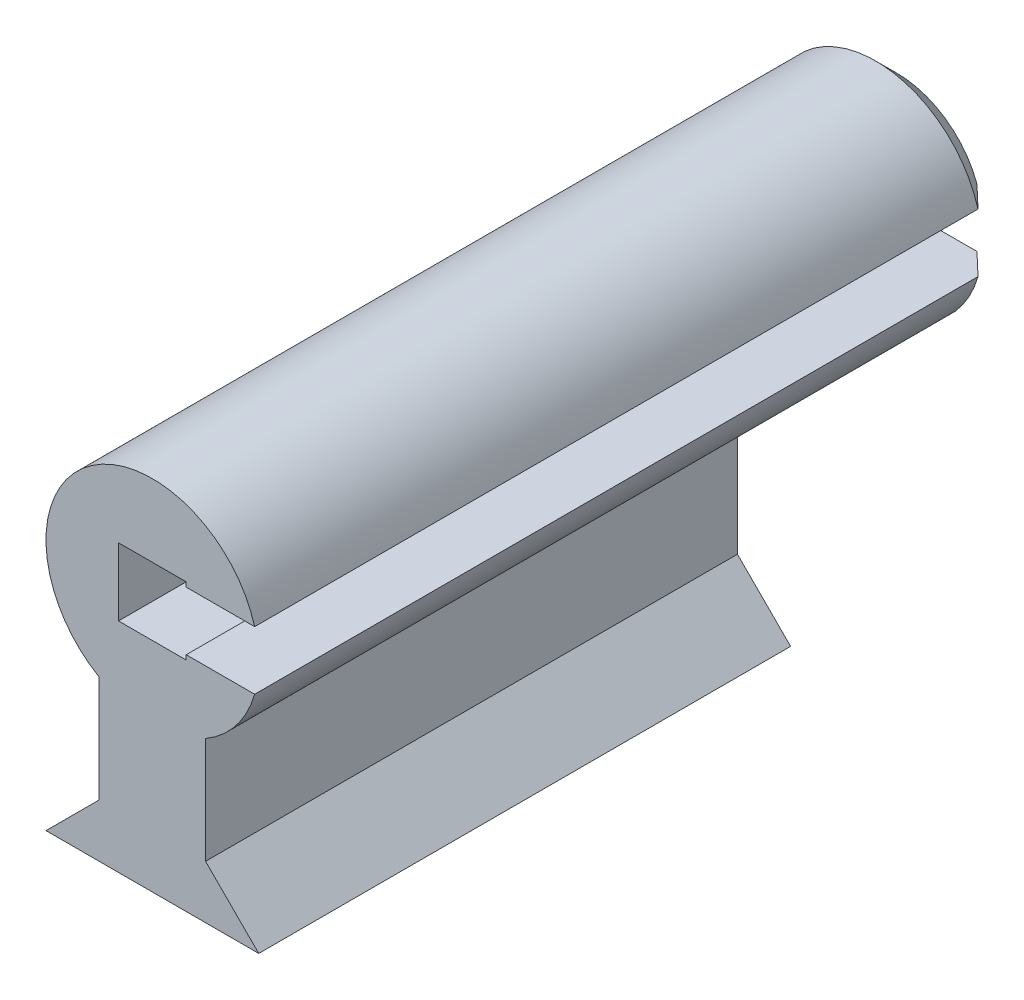
from build123d import *

# Parameters (mm, degrees)
BOSS_EXTRU_1_DEPTH      = 60
BOSS_EXTRU_1_DEPTH_BACK = 10
BOSS_EXTRU_2_START      = -50
BOSS_EXTRU_2_DEPTH      = 50
CHANFREIN1_SIZE         = 2


with BuildPart() as part:
    # Esquisse1 → Boss.-Extru.1 (new, two sides: drawn at the far end of the back side and taken through both)
    with BuildSketch(Plane.XY.offset(-BOSS_EXTRU_1_DEPTH_BACK)):
        with BuildLine():
            Line((3.181980515, 2.75), (3.181980515, 3.181980515))
            Line((3.181980515, 3.181980515), (-3.181980515, 3.181980515))
            Line((-3.181980515, 3.181980515), (-3.181980515, -3.181980515))
            Line((-3.181980515, -3.181980515), (3.181980515, -3.181980515))
            Line((3.181980515, -3.181980515), (3.181980515, -2.75))
            Line((3.181980515, -2.75), (9.614442262, -2.75))
            ThreePointArc((9.614442262, -2.75), (-10, 0), (9.614442262, 2.75))
            Line((9.614442262, 2.75), (3.181980515, 2.75))
        make_face()
    extrude(amount=BOSS_EXTRU_1_DEPTH + BOSS_EXTRU_1_DEPTH_BACK)

    # Esquisse3 → Boss.-Extru.2 (add)
    with BuildSketch(Plane.XY.offset(60).offset(BOSS_EXTRU_2_START)):
        with BuildLine():
            Line((5, -8.660254038), (5, -18.660254038))
            Line((5, -18.660254038), (10, -23.660254038))
            Line((10, -23.660254038), (-10, -23.660254038))
            Line((-10, -23.660254038), (-5, -18.660254038))
            Line((-5, -18.660254038), (-5, -8.660254038))
            ThreePointArc((-5, -8.660254038), (0, -10), (5, -8.660254038))
        make_face()
    extrude(amount=BOSS_EXTRU_2_DEPTH)

    # Chanfrein1
    chanfrein1_edges = [part.edges().sort_by_distance(p)[0] for p in [
        (-10, 0, -10),
    ]]
    chamfer(chanfrein1_edges, length=CHANFREIN1_SIZE)


solid = part.part
